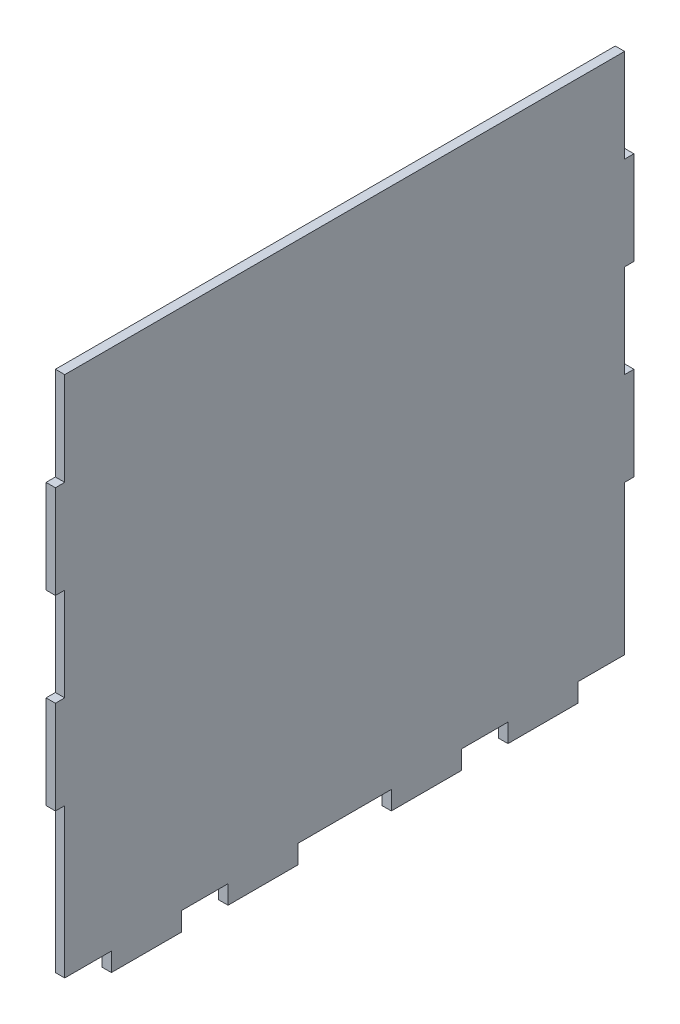
from build123d import *

# Parameters (mm, degrees)
BOSS_EXTRUDE1_DEPTH = 2


with BuildPart() as part:
    # Sketch1 → Boss-Extrude1 (new body)
    with BuildSketch(Plane(origin=(0, 0, 0), x_dir=(0, 0, -1), z_dir=(1, 0, 0))):
        Polygon((-60, -56), (-50, -56), (-50, -60), (-35, -60), (-35, -56), (-25, -56), (-25, -60), (-10, -60), (-10, -56), (10, -56), (10, -60), (25, -60), (25, -56), (35, -56), (35, -60), (50, -60), (50, -56), (60, -56), (60, -24), (62, -24), (62, -4), (60, -4), (60, 16), (62, 16), (62, 36), (60, 36), (60, 56), (-60, 56), (-60, 36), (-62, 36), (-62, 16), (-60, 16), (-60, -4), (-62, -4), (-62, -24), (-60, -24), align=None)
    extrude(amount=BOSS_EXTRUDE1_DEPTH)


solid = part.part
